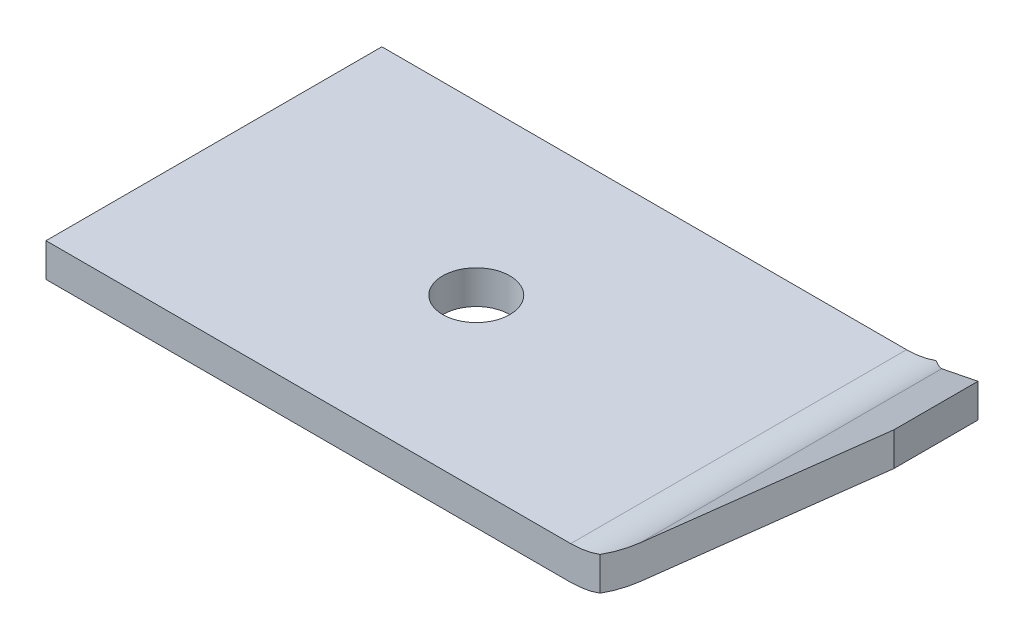
from build123d import *

# Parameters (mm, degrees)
BOSS_EXTRUDE1_DEPTH = 5
SKETCH8_W           = 28.13850749
SKETCH8_H           = 12.868219889
CUT_EXTRUDE5_DEPTH  = 10
SKETCH9_R           = 1
CUT_EXTRUDE6_DEPTH  = 1


with BuildPart() as part:
    # Sketch2 → Boss-Extrude1 (new body)
    with BuildSketch(Plane(origin=(0, 0, 0), x_dir=(1, 0, 0), z_dir=(0, 1, 0))):
        Polygon((16.5, 10), (21.5, 6.25), (21.5, 3.75), (16.5, 0), (0, 0), (0, 10), align=None)
    extrude(amount=BOSS_EXTRUDE1_DEPTH)

    # Sketch8 → Cut-Extrude5 (cut)
    with BuildSketch(Plane.XY):
        with Locations((10.578423735, 2.655771349)):
            Rectangle(SKETCH8_W, SKETCH8_H)
        with BuildLine():
            Line((0, 0), (0, 1))
            Line((0, 1), (15.623047352, 1))
            ThreePointArc((15.623047352, 1), (16.450564705, 1.140929202), (17.18478497, 1.547827976))
            Line((17.18478497, 1.547827976), (21.5, 5))
            Line((21.5, 5), (21.5, 4))
            Line((21.5, 4), (17.18478497, 0.547827976))
            ThreePointArc((17.18478497, 0.547827976), (16.450564705, 0.140929202), (15.623047352, 0))
            Line((15.623047352, 0), (0, 0))
        make_face(mode=Mode.SUBTRACT)
    extrude(amount=-CUT_EXTRUDE5_DEPTH, mode=Mode.SUBTRACT)

    # Sketch9 → Cut-Extrude6 (cut)
    with BuildSketch(Plane(origin=(0, 1, 0), x_dir=(1, 0, 0), z_dir=(0, 1, 0))):
        with Locations(Location((7.811523676, 5, 0), (0, 0, 270))):
            Circle(SKETCH9_R)
    extrude(amount=-CUT_EXTRUDE6_DEPTH, mode=Mode.SUBTRACT)


solid = part.part
